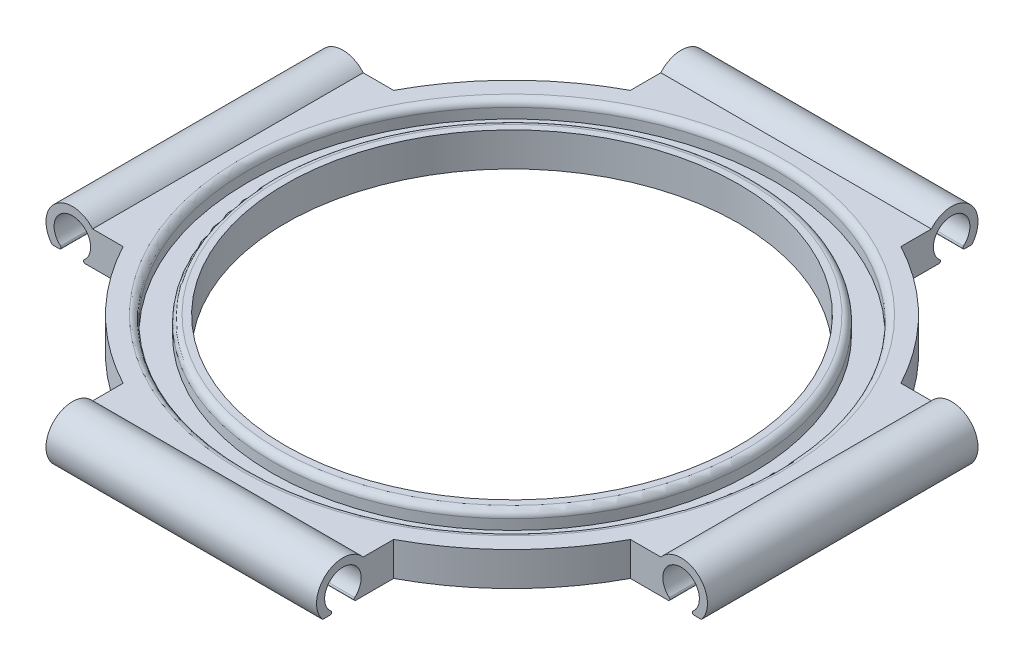
from build123d import *

# Parameters (mm, degrees)
SKETCH_2_R                        = 42.5
SKETCH_2_R_2                      = 33.5
EXTRUDE_1_DEPTH                   = 5
EXTRUDE_2_REACH                   = 103.012
EXTRUDE_2_END_RADIUS              = 42.5
SKETCH_3_W                        = 40
SKETCH_3_H                        = 5
EXTRUDE_4_DEPTH                   = 40
CUT_EXTRUDE_4_DEPTH               = 40
FILLET_2_R                        = 0.25
PATTERN_CIRCULAR_16_COUNT         = 4
FILLET_2_OF_PATTERN_CIRCULAR_16_R = 0.25
SKETCH_6_R                        = 39
SKETCH_6_R_2                      = 35.5
CUT_EXTRUDE_5_DEPTH               = 2.5
FILLET_3_R                        = 1


with BuildPart() as part:
    # Эскиз2 → Бобышка-Вытянуть1 (new body)
    with BuildSketch(Plane(origin=(0, 0, 0), x_dir=(1, 0, 0), z_dir=(0, 1, 0))):
        with Locations(Location((0, 0, 0), (0, 0, 270))):
            Circle(SKETCH_2_R)
        with Locations(Location((0, 0, 0), (0, 0, 270))):
            Circle(SKETCH_2_R_2, mode=Mode.SUBTRACT)
    extrude(amount=EXTRUDE_1_DEPTH)

    # Бобышка-Вытянуть2: up to this cylinder (the profile starts outside it)
    extrude_2_end = Plane(origin=(0, 2.5, 0), z_dir=(0, -1, 0)) * Cylinder(EXTRUDE_2_END_RADIUS, 292.024, mode=Mode.PRIVATE)
    # Эскиз3 → Бобышка-Вытянуть2 (add, up to the surface)
    with BuildSketch(Plane.XY.offset(49), mode=Mode.PRIVATE) as extrude_2_sk1:
        with Locations((0, 2.5)):
            Rectangle(SKETCH_3_W, SKETCH_3_H)
    extrude_2_tool1 = extrude(extrude_2_sk1.sketch, amount=-EXTRUDE_2_REACH, mode=Mode.PRIVATE) - extrude_2_end
    extrude_2 = extrude_2_tool1.solids().sort_by_distance((0, 2.5, 49))[0]
    add(extrude_2)

    # Эскиз13 → Бобышка-Вытянуть4 (add)
    with BuildSketch(Plane(origin=(20, 0, 0), x_dir=(0, 0, -1), z_dir=(1, 0, 0))):
        with BuildLine():
            ThreePointArc((-47.993325909, 0), (-47.444538755, 0.360952762), (-46.8, 0.48753882))
            ThreePointArc((-46.8, 0.48753882), (-47.660526261, 2.960000014), (-46.019803903, 5))
            Line((-46.019803903, 5), (-47.993325909, 5))
            ThreePointArc((-47.993325909, 5), (-48.9, 2.5), (-47.993325909, 0))
        make_face()
        with BuildLine():
            Line((-47.993325909, 5), (-46.019803903, 5))
            ThreePointArc((-46.019803903, 5), (-45, 5.2), (-43.980196097, 5))
            Line((-43.980196097, 5), (-42.006674091, 5))
            ThreePointArc((-42.006674091, 5), (-45, 6.4), (-47.993325909, 5))
        make_face()
        with BuildLine():
            ThreePointArc((-42.3, 2.5), (-42.535248491, 1.397729616), (-43.2, 0.48753882))
            ThreePointArc((-43.2, 0.48753882), (-42.555461245, 0.360952762), (-42.006674091, 0))
            ThreePointArc((-42.006674091, 0), (-41.333668656, 1.170332945), (-41.1, 2.5))
            ThreePointArc((-41.1, 2.5), (-41.333668656, 3.829667055), (-42.006674091, 5))
            Line((-42.006674091, 5), (-43.980196097, 5))
            ThreePointArc((-43.980196097, 5), (-42.759077139, 4.006075938), (-42.3, 2.5))
        make_face()
        with BuildLine():
            ThreePointArc((-43.980196097, 5), (-45, 5.2), (-46.019803903, 5))
            Line((-46.019803903, 5), (-43.980196097, 5))
        make_face()
    extrude_4 = extrude(amount=-EXTRUDE_4_DEPTH)

    # Эскиз13<3> → Вырез-Вытянуть4 (cut)
    with BuildSketch(Plane(origin=(20, 0, 0), x_dir=(0, 0, -1), z_dir=(1, 0, 0))):
        with BuildLine():
            ThreePointArc((-46.019803903, 5), (-47.660526261, 2.960000014), (-46.8, 0.48753882))
            Line((-46.8, 0.48753882), (-43.2, 0.48753882))
            ThreePointArc((-43.2, 0.48753882), (-42.535248491, 1.397729616), (-42.3, 2.5))
            ThreePointArc((-42.3, 2.5), (-42.759077139, 4.006075938), (-43.980196097, 5))
            Line((-43.980196097, 5), (-46.019803903, 5))
        make_face()
        with BuildLine():
            ThreePointArc((-43.980196097, 5), (-45, 5.2), (-46.019803903, 5))
            Line((-46.019803903, 5), (-43.980196097, 5))
        make_face()
        with BuildLine():
            Line((-43.2, 0.48753882), (-46.8, 0.48753882))
            ThreePointArc((-46.8, 0.48753882), (-46.430820407, 0.210294132), (-46.019803903, 0))
            Line((-46.019803903, 0), (-43.980196097, 0))
            ThreePointArc((-43.980196097, 0), (-43.569179593, 0.210294132), (-43.2, 0.48753882))
        make_face()
        with BuildLine():
            Line((-49, 0), (-47.993325909, 0))
            ThreePointArc((-47.993325909, 0), (-48.9, 2.5), (-47.993325909, 5))
            Line((-47.993325909, 5), (-49, 5))
            Line((-49, 5), (-49, 0))
        make_face()
    cut_extrude_4 = extrude(amount=-CUT_EXTRUDE_4_DEPTH, mode=Mode.SUBTRACT)

    # Скругление2
    fillet_2_edges = [part.edges().sort_by_distance(p)[0] for p in [
        (0, 0, 43.980196097),
        (0, 0, 46.019803903),
    ]]
    fillet(fillet_2_edges, radius=FILLET_2_R)

    # Круговой массив16: Бобышка-Вытянуть2, Бобышка-Вытянуть4, Вырез-Вытянуть4 ×4 about axis
    pattern_circular_16_axis = Axis((0, 0, 0), (0, 1, 0))
    add([extrude_2.rotate(pattern_circular_16_axis, i * 360 / PATTERN_CIRCULAR_16_COUNT) for i in range(1, PATTERN_CIRCULAR_16_COUNT)])
    add([extrude_4.rotate(pattern_circular_16_axis, i * 360 / PATTERN_CIRCULAR_16_COUNT) for i in range(1, PATTERN_CIRCULAR_16_COUNT)])
    add([cut_extrude_4.rotate(pattern_circular_16_axis, i * 360 / PATTERN_CIRCULAR_16_COUNT) for i in range(1, PATTERN_CIRCULAR_16_COUNT)], mode=Mode.SUBTRACT)

    # Скругление2 of Круговой массив16
    fillet_2_of_pattern_circular_16_edges = [part.edges().sort_by_distance(p)[0] for p in [
        (43.980196097, 0, 0),
        (46.019803903, 0, 0),
        (0, 0, -43.980196097),
        (0, 0, -46.019803903),
        (-43.980196097, 0, 0),
        (-46.019803903, 0, 0),
    ]]
    fillet(fillet_2_of_pattern_circular_16_edges, radius=FILLET_2_OF_PATTERN_CIRCULAR_16_R)

    # Эскиз6 → Вырез-Вытянуть5 (cut)
    with BuildSketch(Plane(origin=(0, 5, 0), x_dir=(1, 0, 0), z_dir=(0, 1, 0))):
        with Locations(Location((0, 0, 0), (0, 0, 270))):
            Circle(SKETCH_6_R)
        with Locations(Location((0, 0, 0), (0, 0, 270))):
            Circle(SKETCH_6_R_2, mode=Mode.SUBTRACT)
    extrude(amount=-CUT_EXTRUDE_5_DEPTH, mode=Mode.SUBTRACT)

    # Скругление3
    fillet_3_edges = [part.edges().sort_by_distance(p)[0] for p in [
        (0, 5, -39),
        (0, 5, -35.5),
    ]]
    fillet(fillet_3_edges, radius=FILLET_3_R)


solid = part.part
